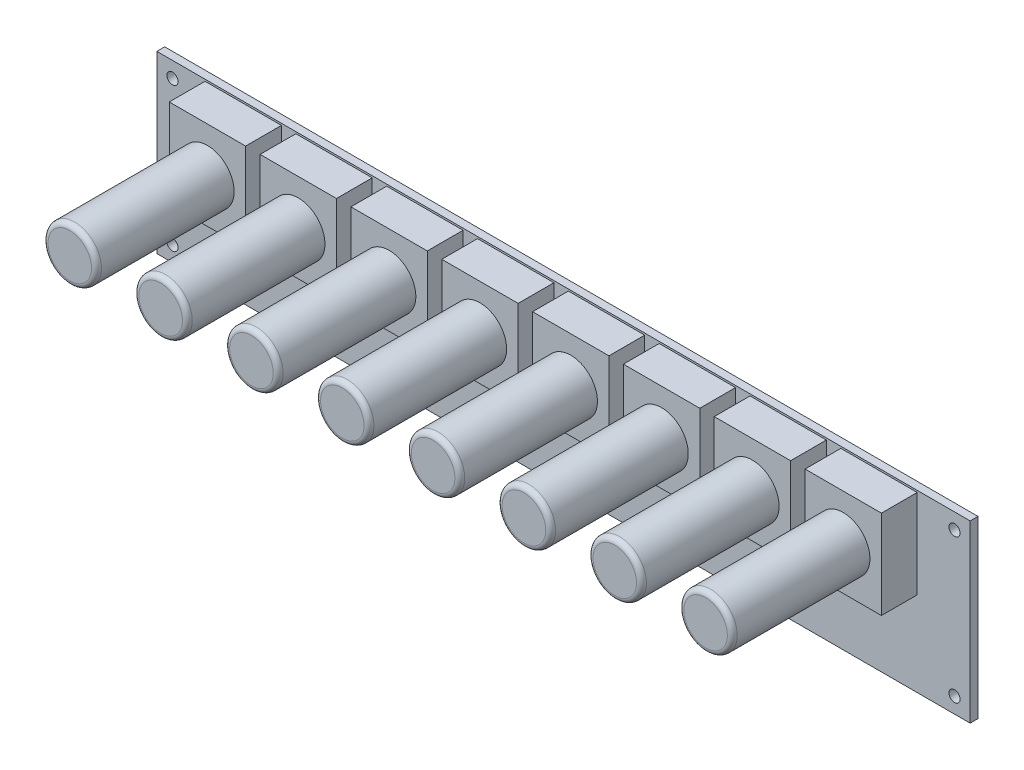
from build123d import *

# Parameters (mm, degrees)
SKETCH1_W                         = 165.1
SKETCH1_H                         = 35.56
BOARD_DEPTH                       = 1.592072
SKETCH2_W                         = 13.208
SKETCH2_H                         = 6.604
CONN_AMP_2X5PIN_100MIL_ST_1_DEPTH = 8.636
SKETCH3_W                         = 13.208
SKETCH3_H                         = 6.604
CONN_AMP_2X5PIN_100MIL_ST_2_DEPTH = 8.636
SKETCH4_W                         = 15.5000198
SKETCH4_H                         = 18.0000148
SWITCH_EC11E15244_1_DEPTH         = 7.2644
SKETCH5_W                         = 15.5000198
SKETCH5_H                         = 18.0000148
SWITCH_EC11E15244_2_DEPTH         = 7.2644
SKETCH6_W                         = 15.5000198
SKETCH6_H                         = 18.0000148
SWITCH_EC11E15244_3_DEPTH         = 7.2644
SKETCH7_W                         = 15.5000198
SKETCH7_H                         = 18.0000148
SWITCH_EC11E15244_4_DEPTH         = 7.2644
SKETCH8_W                         = 15.5000198
SKETCH8_H                         = 18.0000148
SWITCH_EC11E15244_5_DEPTH         = 7.2644
SKETCH9_W                         = 15.5000198
SKETCH9_H                         = 18.0000148
SWITCH_EC11E15244_6_DEPTH         = 7.2644
SKETCH10_W                        = 15.5000198
SKETCH10_H                        = 18.0000148
SWITCH_EC11E15244_7_DEPTH         = 7.2644
SKETCH11_W                        = 15.5000198
SKETCH11_H                        = 18.0000148
SWITCH_EC11E15244_8_DEPTH         = 7.2644
SKETCH12_R                        = 5.42
BOSS_EXTRUDE12_DEPTH              = 27.94
FILLET2_R                         = 1
LPATTERN1_COUNT                   = 8
LPATTERN1_PITCH                   = 18.4375
FILLET2_OF_LPATTERN1_R            = 1
SKETCH13_R                        = 1.1303
CUT_EXTRUDE1_DEPTH                = 2.54


with BuildPart() as part:
    # Sketch1 → BOARD (new body)
    with BuildSketch(Plane.XY):
        with Locations((82.55, 17.78)):
            Rectangle(SKETCH1_W, SKETCH1_H)
    extrude(amount=BOARD_DEPTH)

    # Sketch13 → Cut-Extrude1 (cut)
    with BuildSketch(Plane.XY.offset(1.592072)):
        with Locations((3.175, 32.385)):
            Circle(SKETCH13_R)
        with Locations((3.175, 3.175)):
            Circle(SKETCH13_R)
        with Locations((161.925, 3.175)):
            Circle(SKETCH13_R)
        with Locations((161.925, 32.385)):
            Circle(SKETCH13_R)
    extrude(amount=-CUT_EXTRUDE1_DEPTH, mode=Mode.SUBTRACT)


with BuildPart() as body_2:
    # Sketch2 → CONN-AMP-2X5PIN-100MIL-ST-1 (new body)
    with BuildSketch(Plane.XY):
        with Locations((93.8403, 12.0904)):
            Rectangle(SKETCH2_W, SKETCH2_H)
    extrude(amount=-CONN_AMP_2X5PIN_100MIL_ST_1_DEPTH)


with BuildPart() as body_3:
    # Sketch3 → CONN-AMP-2X5PIN-100MIL-ST-2 (new body)
    with BuildSketch(Plane.XY):
        with Locations((26.3017, 12.573)):
            Rectangle(SKETCH3_W, SKETCH3_H)
    extrude(amount=-CONN_AMP_2X5PIN_100MIL_ST_2_DEPTH)


with BuildPart() as body_4:
    # Sketch4 → SWITCH-EC11E15244-1 (new body)
    with BuildSketch(Plane.XY.offset(1.592072)):
        with Locations((146.6012435, 26.1874)):
            Rectangle(SKETCH4_W, SKETCH4_H)
    extrude(amount=SWITCH_EC11E15244_1_DEPTH)


with BuildPart() as body_5:
    # Sketch5 → SWITCH-EC11E15244-2 (new body)
    with BuildSketch(Plane.XY.offset(1.592072)):
        with Locations((128.1637391, 26.1874)):
            Rectangle(SKETCH5_W, SKETCH5_H)
    extrude(amount=SWITCH_EC11E15244_2_DEPTH)


with BuildPart() as body_6:
    # Sketch6 → SWITCH-EC11E15244-3 (new body)
    with BuildSketch(Plane.XY.offset(1.592072)):
        with Locations((109.7262347, 26.1874)):
            Rectangle(SKETCH6_W, SKETCH6_H)
    extrude(amount=SWITCH_EC11E15244_3_DEPTH)


with BuildPart() as body_7:
    # Sketch7 → SWITCH-EC11E15244-4 (new body)
    with BuildSketch(Plane.XY.offset(1.592072)):
        with Locations((91.2887303, 26.1874)):
            Rectangle(SKETCH7_W, SKETCH7_H)
    extrude(amount=SWITCH_EC11E15244_4_DEPTH)


with BuildPart() as body_8:
    # Sketch8 → SWITCH-EC11E15244-5 (new body)
    with BuildSketch(Plane.XY.offset(1.592072)):
        with Locations((72.8512259, 26.1874)):
            Rectangle(SKETCH8_W, SKETCH8_H)
    extrude(amount=SWITCH_EC11E15244_5_DEPTH)


with BuildPart() as body_9:
    # Sketch9 → SWITCH-EC11E15244-6 (new body)
    with BuildSketch(Plane.XY.offset(1.592072)):
        with Locations((54.4137215, 26.1874)):
            Rectangle(SKETCH9_W, SKETCH9_H)
    extrude(amount=SWITCH_EC11E15244_6_DEPTH)


with BuildPart() as body_10:
    # Sketch10 → SWITCH-EC11E15244-7 (new body)
    with BuildSketch(Plane.XY.offset(1.592072)):
        with Locations((35.9762171, 26.1874)):
            Rectangle(SKETCH10_W, SKETCH10_H)
    extrude(amount=SWITCH_EC11E15244_7_DEPTH)


with BuildPart() as body_11:
    # Sketch11 → SWITCH-EC11E15244-8 (new body)
    with BuildSketch(Plane.XY.offset(1.592072)):
        with Locations((17.5387127, 26.1874)):
            Rectangle(SKETCH11_W, SKETCH11_H)
    extrude(amount=SWITCH_EC11E15244_8_DEPTH)

    # Sketch12 → Boss-Extrude12 (add)
    with BuildSketch(Plane.XY.offset(8.856472)):
        with Locations(Location((17.5387127, 26, 0), (0, 0, 180))):
            Circle(SKETCH12_R)
    boss_extrude12 = extrude(amount=BOSS_EXTRUDE12_DEPTH)

    # Fillet2
    fillet2_edges = [body_11.edges().sort_by_distance(p)[0] for p in [
        (22.9587127, 26, 36.796472),
    ]]
    fillet(fillet2_edges, radius=FILLET2_R)


with BuildPart() as body_4_1:
    add(body_4.part)

    add(body_5.part)  # LPattern1 merges body 5

    add(body_6.part)  # LPattern1 merges body 6

    add(body_7.part)  # LPattern1 merges body 7

    add(body_8.part)  # LPattern1 merges body 8

    add(body_9.part)  # LPattern1 merges body 9

    add(body_10.part)  # LPattern1 merges body 10
    # LPattern1: Boss-Extrude12 ×8
    with Locations(*[(i * LPATTERN1_PITCH, 0, 0) for i in range(1, LPATTERN1_COUNT)]):
        add(boss_extrude12)

    # Fillet2 of LPattern1
    fillet2_of_lpattern1_edges = [body_4_1.edges().sort_by_distance(p)[0] for p in [
        (41.3962127, 26, 36.796472),
        (59.8337127, 26, 36.796472),
        (78.2712127, 26, 36.796472),
        (96.7087127, 26, 36.796472),
        (115.1462127, 26, 36.796472),
        (133.5837127, 26, 36.796472),
        (152.0212127, 26, 36.796472),
    ]]
    fillet(fillet2_of_lpattern1_edges, radius=FILLET2_OF_LPATTERN1_R)


solid = Compound([part.part, body_2.part, body_3.part, body_11.part, body_4_1.part])
